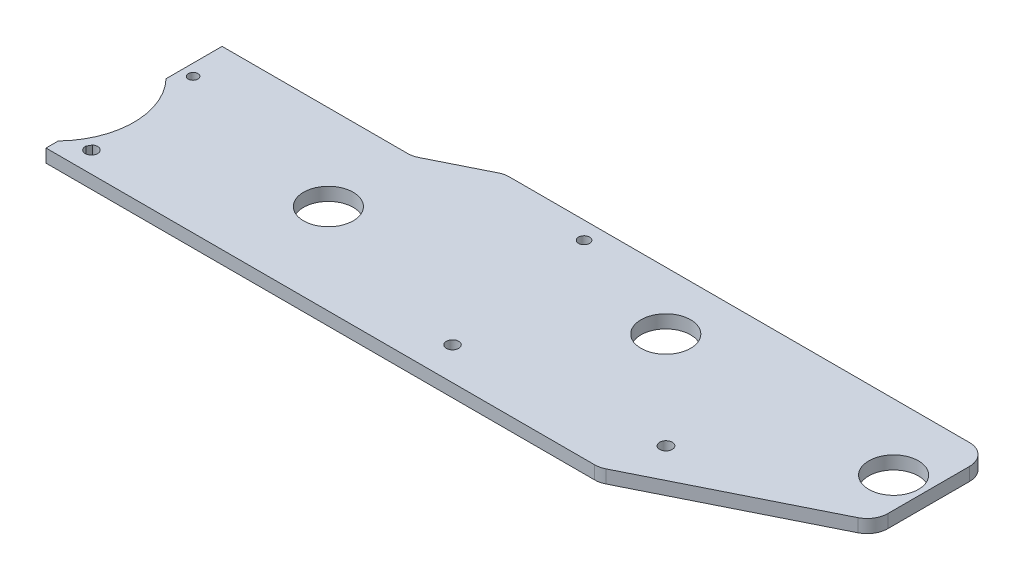
from build123d import *

# Parameters (mm, degrees)
SKETCH1_W           = 210
SKETCH1_H           = 50
SKETCH1_R           = 1.211665018
SKETCH1_R_2         = 1.165617118
SKETCH1_R_3         = 1.5
SKETCH1_R_4         = 1.517273905
SKETCH1_R_5         = 1.335614121
SKETCH1_R_6         = 1.62438417
BOSS_EXTRUDE1_DEPTH = 3.175
SKETCH2_R           = 2
CUT_EXTRUDE1_DEPTH  = 10
SKETCH3_R           = 6
SKETCH3_R_2         = 0.586995366
CUT_EXTRUDE2_DEPTH  = 57.15
CUT_EXTRUDE7_DEPTH  = 10
FILLET3_R           = 5
SKETCH11_R          = 18.5
SKETCH11_R_2        = 2
BOSS_EXTRUDE4_DEPTH = 3.175
SKETCH12_R          = 21
BOSS_EXTRUDE5_DEPTH = 3.175
SKETCH13_R          = 18.85
CUT_EXTRUDE8_DEPTH  = 3.175
BOSS_EXTRUDE6_DEPTH = 3.175
FILLET4_R           = 5
SKETCH15_R          = 1.5
CUT_EXTRUDE9_DEPTH  = 10
SKETCH16_R          = 1.5
CUT_EXTRUDE10_DEPTH = 10
SKETCH17_R          = 1.5
CUT_EXTRUDE11_DEPTH = 10
CUT_EXTRUDE12_DEPTH = 10


with BuildPart() as part:
    # Sketch1 → Boss-Extrude1 (new body)
    with BuildSketch(Plane(origin=(0, 0, 0), x_dir=(1, 0, 0), z_dir=(0, 1, 0))):
        with Locations((105, -25)):
            Rectangle(SKETCH1_W, SKETCH1_H)
        with Locations(Location((3.489526233, -16.787661112, 0), (0, 0, 270))):
            Circle(SKETCH1_R, mode=Mode.SUBTRACT)
        with Locations(Location((34.37258772, -17.194005245, 0), (0, 0, 270))):
            Circle(SKETCH1_R_2, mode=Mode.SUBTRACT)
        with Locations(Location((37.520749958, -44.921198121, 0), (0, 0, 270))):
            Circle(SKETCH1_R_3, mode=Mode.SUBTRACT)
        with Locations(Location((168.975233936, -37.403209633, 0), (0, 0, 270))):
            Circle(SKETCH1_R_4, mode=Mode.SUBTRACT)
        with Locations(Location((116, -4.237214774, 0), (0, 0, 270))):
            Circle(SKETCH1_R_5, mode=Mode.SUBTRACT)
        with Locations(Location((12.257640281, -3.274812063, 0), (0, 0, 270))):
            Circle(SKETCH1_R_6, mode=Mode.SUBTRACT)
    extrude(amount=BOSS_EXTRUDE1_DEPTH)

    # Sketch2 → Cut-Extrude1 (cut)
    with BuildSketch(Plane(origin=(0, 3.175, 0), x_dir=(1, 0, 0), z_dir=(0, 1, 0))):
        with Locations(Location((10, -26, 0), (0, 0, 270))):
            Circle(SKETCH2_R)
        with Locations(Location((10, -42, 0), (0, 0, 270))):
            Circle(SKETCH2_R)
        with Locations(Location((26, -26, 0), (0, 0, 270))):
            Circle(SKETCH2_R)
        with Locations(Location((26, -42, 0), (0, 0, 270))):
            Circle(SKETCH2_R)
    extrude(amount=-CUT_EXTRUDE1_DEPTH, mode=Mode.SUBTRACT)

    # Sketch3 → Cut-Extrude2 (cut)
    with BuildSketch(Plane(origin=(0, 3.175, 0), x_dir=(1, 0, 0), z_dir=(0, 1, 0))):
        with Locations(Location((78.01026379, -28.1, 0), (0, 0, 270))):
            Circle(SKETCH3_R)
        with Locations(Location((145.531297368, -14, 0), (0, 0, 270))):
            Circle(SKETCH3_R)
        with Locations(Location((18, -34, 0), (0, 0, 270))):
            Circle(SKETCH3_R_2)
        with Locations(Location((202.646291021, -16, 0), (0, 0, 270))):
            Circle(SKETCH3_R)
    extrude(amount=-CUT_EXTRUDE2_DEPTH, mode=Mode.SUBTRACT)

    # Sketch10 → Cut-Extrude7 (cut)
    with BuildSketch(Plane(origin=(0, 3.175, 0), x_dir=(1, 0, 0), z_dir=(0, 1, 0))):
        Polygon((210, -27.859435908), (165.502877994, -50), (210, -50), align=None)
        Polygon((92.532613397, 0), (77.65477062, -7.402812063), (0, -7.402812063), (0, 0), align=None)
    extrude(amount=-CUT_EXTRUDE7_DEPTH, mode=Mode.SUBTRACT)

    # Fillet3
    fillet3_edges = [part.edges().sort_by_distance(p)[0] for p in [
        (210, 1.5875, 0),
        (0, 1.5875, 50),
        (92.532613397, 1.5875, 0),
        (210, 1.5875, 27.859435908),
        (165.502877994, 1.5875, 50),
        (77.65477062, 1.5875, 7.402812063),
        (0, 1.5875, 7.402812063),
    ]]
    fillet(fillet3_edges, radius=FILLET3_R)

    # Sketch11 → Boss-Extrude4 (add)
    with BuildSketch(Plane(origin=(0, 3.175, 0), x_dir=(1, 0, 0), z_dir=(0, 1, 0))):
        with Locations((18, -34)):
            Circle(SKETCH11_R)
        with Locations(Location((10, -26, 0), (0, 0, 270))):
            Circle(SKETCH11_R_2, mode=Mode.SUBTRACT)
        with Locations(Location((10, -42, 0), (0, 0, 270))):
            Circle(SKETCH11_R_2, mode=Mode.SUBTRACT)
        with Locations(Location((26, -26, 0), (0, 0, 270))):
            Circle(SKETCH11_R_2, mode=Mode.SUBTRACT)
        with Locations(Location((26, -42, 0), (0, 0, 270))):
            Circle(SKETCH11_R_2, mode=Mode.SUBTRACT)
    extrude(amount=-BOSS_EXTRUDE4_DEPTH)

    # Sketch12 → Boss-Extrude5 (add)
    with BuildSketch(Plane(origin=(0, 3.175, 0), x_dir=(1, 0, 0), z_dir=(0, 1, 0))):
        with Locations((18, -34)):
            Circle(SKETCH12_R)
    extrude(amount=-BOSS_EXTRUDE5_DEPTH)

    # Sketch13 → Cut-Extrude8 (cut)
    with BuildSketch(Plane(origin=(0, 3.175, 0), x_dir=(1, 0, 0), z_dir=(0, 1, 0))):
        with Locations(Location((18, -34, 0), (0, 0, 270))):
            Circle(SKETCH13_R)
    extrude(amount=-CUT_EXTRUDE8_DEPTH, mode=Mode.SUBTRACT)

    # Sketch14 → Boss-Extrude6 (add)
    with BuildSketch(Plane(origin=(0, 3.175, 0), x_dir=(1, 0, 0), z_dir=(0, 1, 0))):
        with BuildLine():
            Line((-35.83, -34.272812063), (-2.998227868, -34.272812063))
            ThreePointArc((-2.998227868, -34.272812063), (-2.272136238, -28.519079241), (0, -23.183346174))
            Line((0, -23.183346174), (0, -12.402812063))
            Line((0, -12.402812063), (0, -12.248529085))
            Line((0, -12.248529085), (0, 0.727187937))
            Line((0, 0.727187937), (-35.83, 0.727187937))
            Line((-35.83, 0.727187937), (-35.83, -34.272812063))
        make_face()
        with BuildLine():
            Line((0, 0.727187937), (0, -12.248529085))
            Line((0, -12.248529085), (0.002380891, -12.248529085))
            ThreePointArc((0.002380891, -12.248529085), (1.51944077, -8.813145304), (5, -7.402812063))
            Line((5, -7.402812063), (18, -7.402812063))
            Line((18, -7.402812063), (18, 0.727187937))
            Line((18, 0.727187937), (0, 0.727187937))
        make_face()
    extrude(amount=-BOSS_EXTRUDE6_DEPTH)

    # Fillet4
    fillet4_edges = [part.edges().sort_by_distance(p)[0] for p in [
        (-35.83, 1.5875, 34.272812063),
        (-35.83, 1.5875, -0.727187937),
        (18, 1.5875, -0.727187937),
    ]]
    fillet(fillet4_edges, radius=FILLET4_R)

    # Sketch15 → Cut-Extrude9 (cut)
    with BuildSketch(Plane(origin=(0, 3.175, 0), x_dir=(1, 0, 0), z_dir=(0, 1, 0))):
        with Locations(Location((122, -42.058139805, 0), (0, 0, 270))):
            Circle(SKETCH15_R)
    extrude(amount=-CUT_EXTRUDE9_DEPTH, mode=Mode.SUBTRACT)

    # Sketch16 → Cut-Extrude10 (cut)
    with BuildSketch(Plane(origin=(0, 3.175, 0), x_dir=(1, 0, 0), z_dir=(0, 1, 0))):
        with Locations(Location((12, -3.272812063, 0), (0, 0, 270))):
            Circle(SKETCH16_R)
    extrude(amount=-CUT_EXTRUDE10_DEPTH, mode=Mode.SUBTRACT)

    # Sketch17 → Cut-Extrude11 (cut)
    with BuildSketch(Plane(origin=(0, 3.175, 0), x_dir=(1, 0, 0), z_dir=(0, 1, 0))):
        with Locations(Location((-30.83, -15.772812063, 0), (0, 0, 270))):
            Circle(SKETCH17_R)
    extrude(amount=-CUT_EXTRUDE11_DEPTH, mode=Mode.SUBTRACT)

    # Sketch18 → Cut-Extrude12 (cut)
    with BuildSketch(Plane(origin=(0, 3.175, 0), x_dir=(1, 0, 0), z_dir=(0, 1, 0))):
        Polygon((31.601470509, -50), (31.601470509, 19.941328263), (-46.231581419, 19.941328263), (-46.231581419, -56.249580014), (31.601470509, -57.692191912), align=None)
    extrude(amount=-CUT_EXTRUDE12_DEPTH, mode=Mode.SUBTRACT)


solid = part.part
